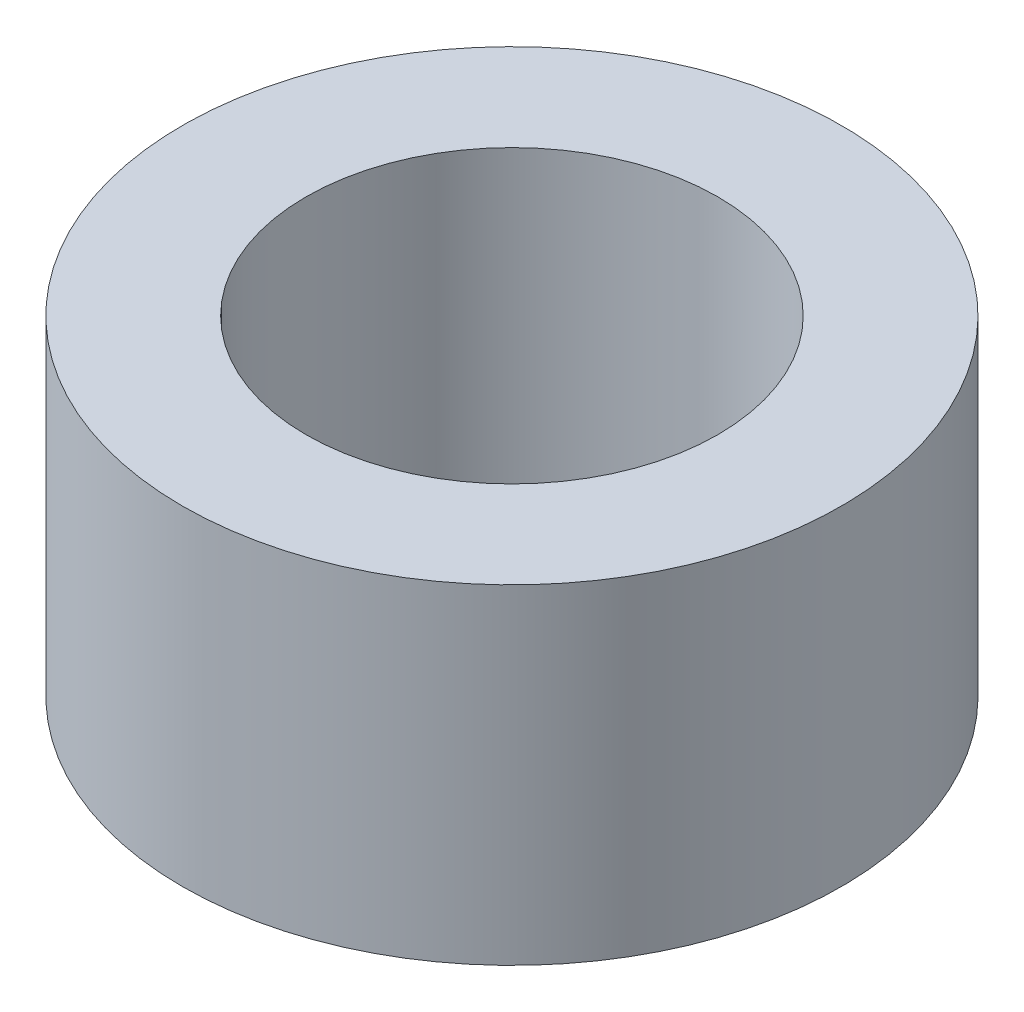
from build123d import *

# Parameters (mm, degrees)
SKETCH1_R           = 20
SKETCH1_R_2         = 12.5
BOSS_EXTRUDE1_DEPTH = 10


with BuildPart() as part:
    # Sketch1 → Boss-Extrude1 (new, symmetric)
    with BuildSketch(Plane(origin=(0, 0, 0), x_dir=(1, 0, 0), z_dir=(0, 1, 0))):
        with Locations(Location((0, 0, 0), (0, 0, 270))):
            Circle(SKETCH1_R)
        with Locations(Location((0, 0, 0), (0, 0, 270))):
            Circle(SKETCH1_R_2, mode=Mode.SUBTRACT)
    extrude(amount=BOSS_EXTRUDE1_DEPTH, both=True)


solid = part.part
